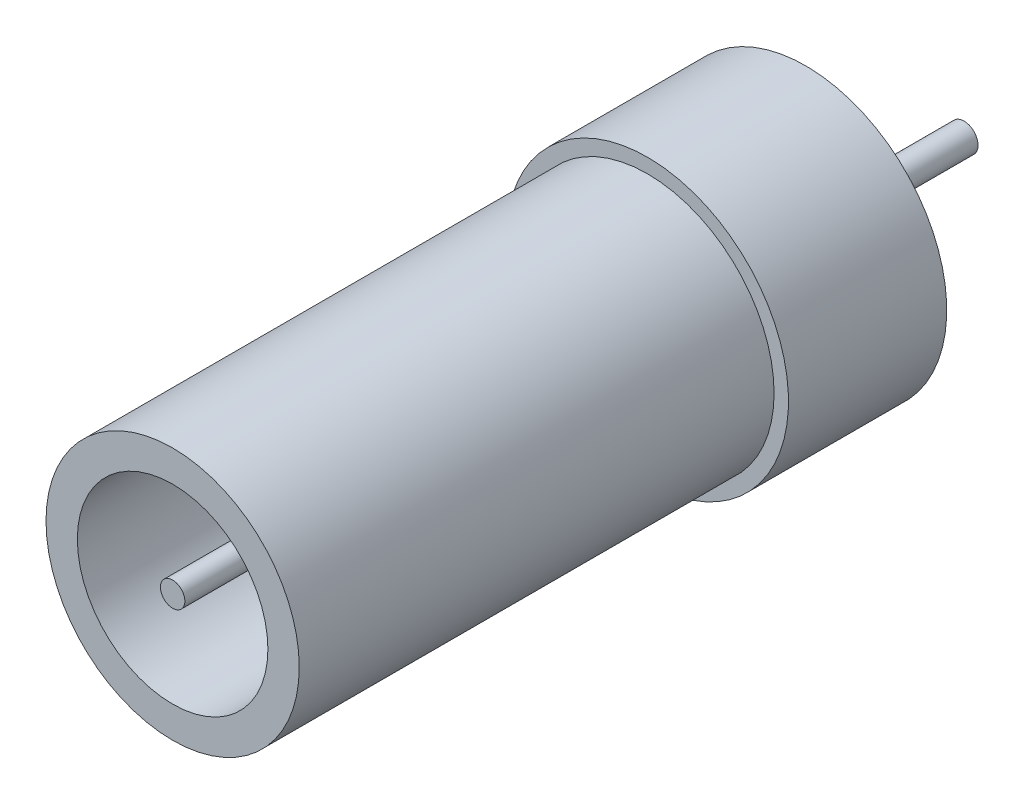
from build123d import *

# Parameters (mm, degrees)
SKETCH1_R           = 4
SKETCH1_R_2         = 3
BOSS_EXTRUDE1_DEPTH = 15
SKETCH2_R           = 3
BOSS_EXTRUDE3_DEPTH = 15
SKETCH3_R           = 3.009782436
SKETCH3_R_2         = 0.386251133
CUT_EXTRUDE2_DEPTH  = 13
SKETCH4_R           = 4.454105624
BOSS_EXTRUDE4_DEPTH = 5
SKETCH5_R           = 0.442435296
BOSS_EXTRUDE5_DEPTH = 5


with BuildPart() as part:
    # Sketch1 → Boss-Extrude1 (new body)
    with BuildSketch(Plane.XY):
        Circle(SKETCH1_R)
        Circle(SKETCH1_R_2, mode=Mode.SUBTRACT)
    extrude(amount=BOSS_EXTRUDE1_DEPTH)

    # Sketch2 → Boss-Extrude3 (add)
    with BuildSketch(Plane(origin=(0, 0, 0), x_dir=(-1, 0, 0), z_dir=(0, 0, -1))):
        Circle(SKETCH2_R)
    extrude(amount=-BOSS_EXTRUDE3_DEPTH)

    # Sketch3 → Cut-Extrude2 (cut)
    with BuildSketch(Plane.XY.offset(15)):
        Circle(SKETCH3_R)
        Circle(SKETCH3_R_2, mode=Mode.SUBTRACT)
    extrude(amount=-CUT_EXTRUDE2_DEPTH, mode=Mode.SUBTRACT)

    # Sketch4 → Boss-Extrude4 (add)
    with BuildSketch(Plane(origin=(0, 0, 0), x_dir=(-1, 0, 0), z_dir=(0, 0, -1))):
        Circle(SKETCH4_R)
    extrude(amount=BOSS_EXTRUDE4_DEPTH)

    # Sketch5 → Boss-Extrude5 (add)
    with BuildSketch(Plane(origin=(0, 0, -5), x_dir=(-1, 0, 0), z_dir=(0, 0, -1))):
        Circle(SKETCH5_R)
    extrude(amount=BOSS_EXTRUDE5_DEPTH)


solid = part.part
